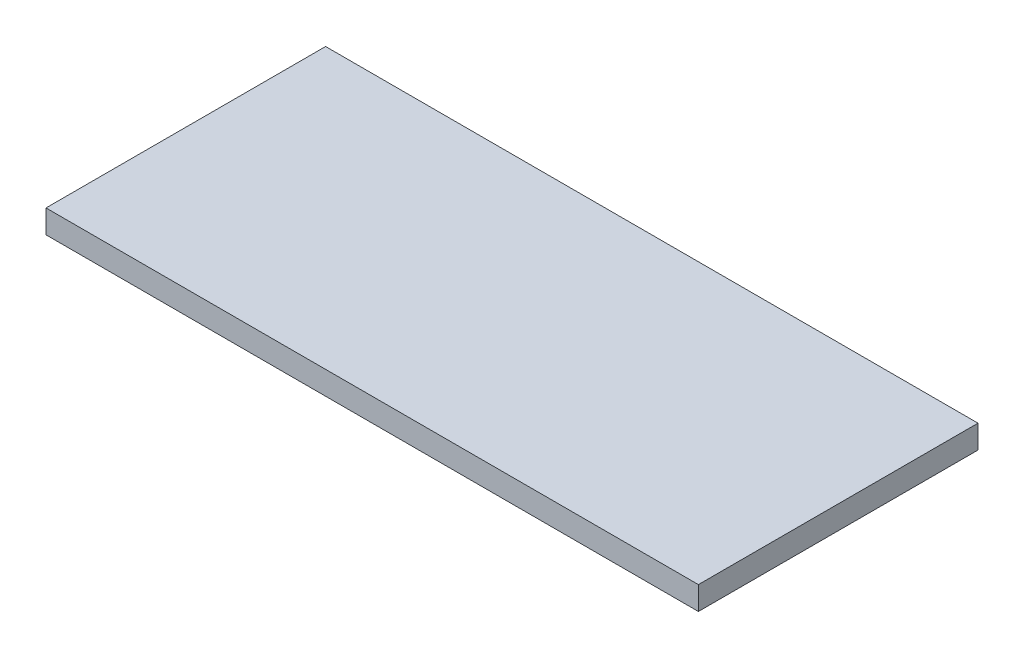
from build123d import *

# Parameters (mm, degrees)
SKETCH1_W           = 88.9
SKETCH1_H           = 38.1
BOSS_EXTRUDE1_DEPTH = 3.175


with BuildPart() as part:
    # Sketch1 → Boss-Extrude1 (new body)
    with BuildSketch(Plane(origin=(0, 0, 0), x_dir=(1, 0, 0), z_dir=(0, 1, 0))):
        Rectangle(SKETCH1_W, SKETCH1_H)
    extrude(amount=BOSS_EXTRUDE1_DEPTH)


solid = part.part
